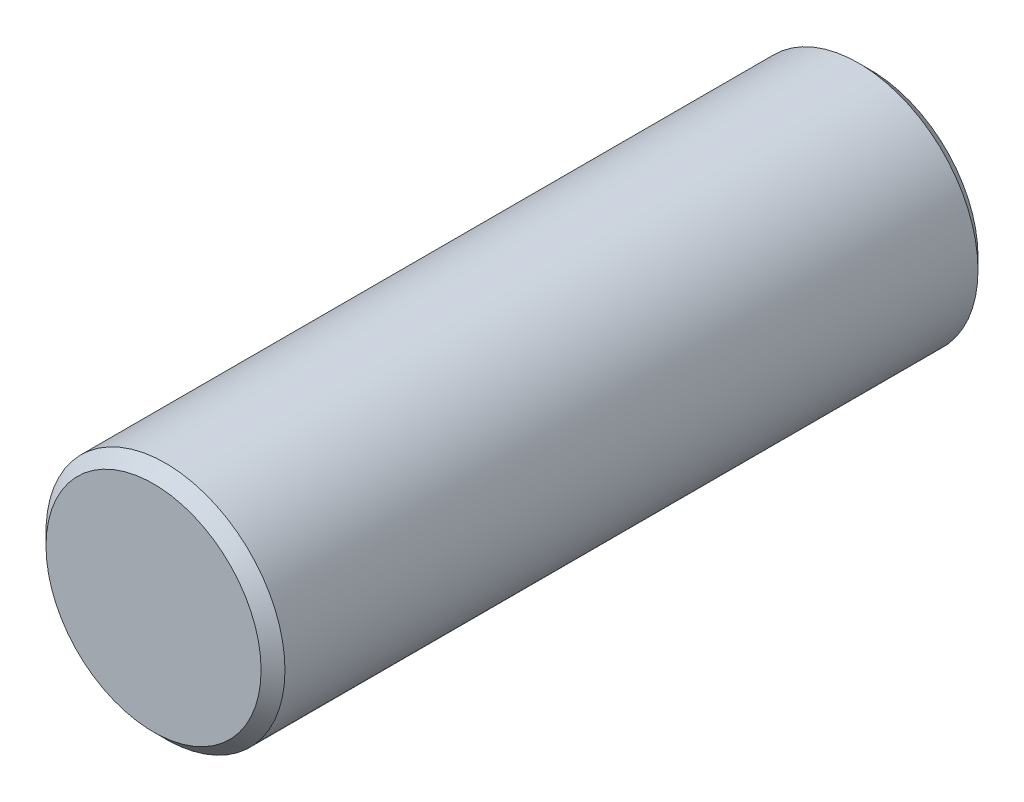
from build123d import *

# Parameters (mm, degrees)
SKETCH_1_R      = 10
EXTRUDE_1_DEPTH = 60
CHAMFER_1_SIZE  = 1


with BuildPart() as part:
    # Эскиз1 → Бобышка-Вытянуть1 (new body)
    with BuildSketch(Plane.XY):
        Circle(SKETCH_1_R)
    extrude(amount=EXTRUDE_1_DEPTH)

    # Фаска1
    chamfer_1_edges = [part.edges().sort_by_distance(p)[0] for p in [
        (-10, 0, 0),
        (-10, 0, 60),
    ]]
    chamfer(chamfer_1_edges, length=CHAMFER_1_SIZE)


solid = part.part
